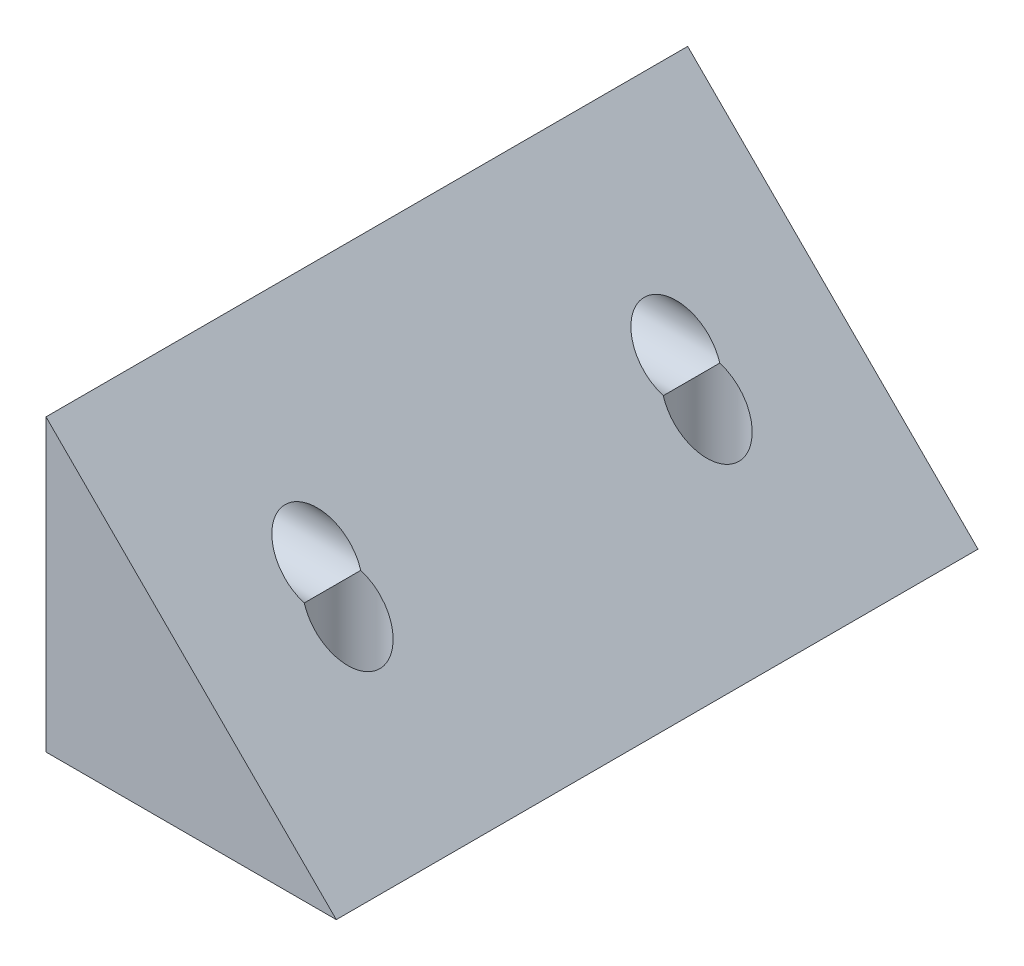
from build123d import *

# Parameters (mm, degrees)
EXTRUDE_2_DEPTH     = 42
SKETCH_4_R          = 2.1
CUT_EXTRUDE_2_DEPTH = 42
SKETCH_5_R          = 2.1
CUT_EXTRUDE_3_DEPTH = 42


with BuildPart() as part:
    # 草图1 → 凸台-拉伸2 (new body)
    with BuildSketch(Plane.XY):
        Polygon((19, 0), (0, 0), (0, 19), align=None)
    extrude(amount=EXTRUDE_2_DEPTH)

    # 草图4 → 切除-拉伸2 (cut)
    with BuildSketch(Plane(origin=(0, 0, 0), x_dir=(-1, 0, 0), z_dir=(0, -1, 0))):
        with Locations(Location((-10.5, -32.75, 0), (0, 0, 90))):
            Circle(SKETCH_4_R)
        with Locations(Location((-10.5, -9.25, 0), (0, 0, 180))):
            Circle(SKETCH_4_R)
    extrude(amount=-CUT_EXTRUDE_2_DEPTH, mode=Mode.SUBTRACT)

    # 草图5 → 切除-拉伸3 (cut)
    with BuildSketch(Plane.ZY):
        with Locations((32.75, 10.5)):
            Circle(SKETCH_5_R)
        with Locations(Location((9.25, 10.5, 0), (0, 0, 331.563109851))):
            Circle(SKETCH_5_R)
    extrude(amount=-CUT_EXTRUDE_3_DEPTH, mode=Mode.SUBTRACT)


solid = part.part
